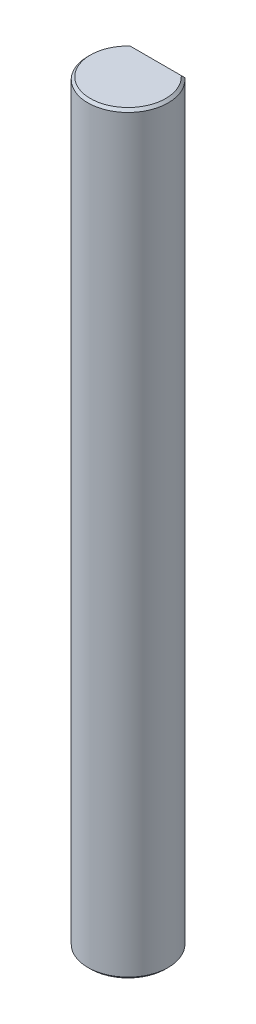
from build123d import *

# Parameters (mm, degrees)
SKETCH1_R               = 4
BOSS_EXTRUDE1_DEPTH     = 75
CUT_EXTRUDE1_DEPTH      = 76.213030786
CUT_EXTRUDE1_DEPTH_BACK = 76.213030786
CHAMFER1_SIZE           = 0.25


with BuildPart() as part:
    # Sketch1 → Boss-Extrude1 (new body)
    with BuildSketch(Plane(origin=(0, 0, 0), x_dir=(1, 0, 0), z_dir=(0, 1, 0))):
        with Locations(Location((0, 0, 0), (0, 0, 270))):
            Circle(SKETCH1_R)
    extrude(amount=BOSS_EXTRUDE1_DEPTH)

    # Sketch2 → Cut-Extrude1 (cut, two sides: drawn at the far end of the back side and taken through both)
    with BuildSketch(Plane(origin=(0, 75, 0), x_dir=(1, 0, 0), z_dir=(0, 1, 0)).offset(-CUT_EXTRUDE1_DEPTH_BACK)):
        with BuildLine():
            Line((-4, 3), (4, 3))
            ThreePointArc((4, 3), (0, 5), (-4, 3))
        make_face()
    extrude(amount=CUT_EXTRUDE1_DEPTH + CUT_EXTRUDE1_DEPTH_BACK, mode=Mode.SUBTRACT)

    # Chamfer1
    chamfer1_edges = [part.edges().sort_by_distance(p)[0] for p in [
        (0, 0, 4),
        (0, 0, -3),
        (0, 75, 4),
        (0, 75, -3),
    ]]
    chamfer(chamfer1_edges, length=CHAMFER1_SIZE)


solid = part.part
